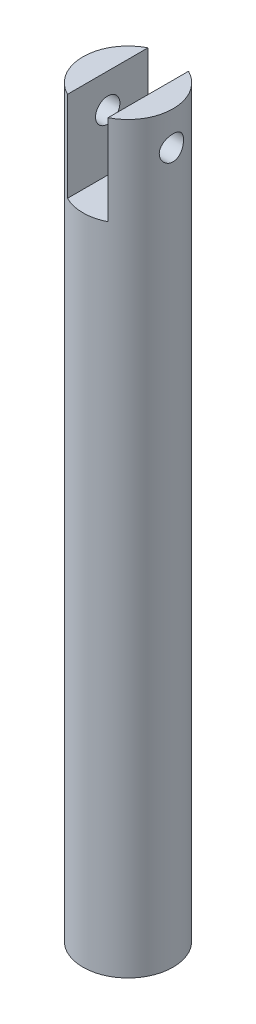
from build123d import *

# Parameters (mm, degrees)
SKETCH1_R               = 10
BOSS_EXTRUDE1_DEPTH     = 165
CUT_EXTRUDE1_DEPTH      = 166.604951617
CUT_EXTRUDE1_DEPTH_BACK = 166.604951617
SKETCH2_W               = 9
SKETCH2_H               = 40
CUT_EXTRUDE2_DEPTH      = 166.604951617
CUT_EXTRUDE2_DEPTH_BACK = 166.604951617
SKETCH3_R               = 2.7


with BuildPart() as part:
    # Sketch1 → Boss-Extrude1 (new body)
    with BuildSketch(Plane(origin=(0, 0, 0), x_dir=(1, 0, 0), z_dir=(0, 1, 0))):
        with Locations(Location((0, 0, 0), (0, 0, 270))):
            Circle(SKETCH1_R)
    extrude(amount=BOSS_EXTRUDE1_DEPTH)

    # Sketch2 → Cut-Extrude1 (cut, two sides: drawn at the far end of the back side and taken through both)
    with BuildSketch(Plane.XY.offset(-CUT_EXTRUDE1_DEPTH_BACK)):
        with Locations((0, 165)):
            Rectangle(SKETCH2_W, SKETCH2_H)
    extrude(amount=CUT_EXTRUDE1_DEPTH + CUT_EXTRUDE1_DEPTH_BACK, mode=Mode.SUBTRACT)

    # Sketch3 → Cut-Extrude2 (cut, two sides: drawn at the far end of the back side and taken through both)
    with BuildSketch(Plane(origin=(0, 0, 0), x_dir=(0, 0, -1), z_dir=(1, 0, 0)).offset(-CUT_EXTRUDE2_DEPTH_BACK)):
        with Locations(Location((0, 157.5, 0), (0, 0, 270))):
            Circle(SKETCH3_R)
    extrude(amount=CUT_EXTRUDE2_DEPTH + CUT_EXTRUDE2_DEPTH_BACK, mode=Mode.SUBTRACT)


solid = part.part
